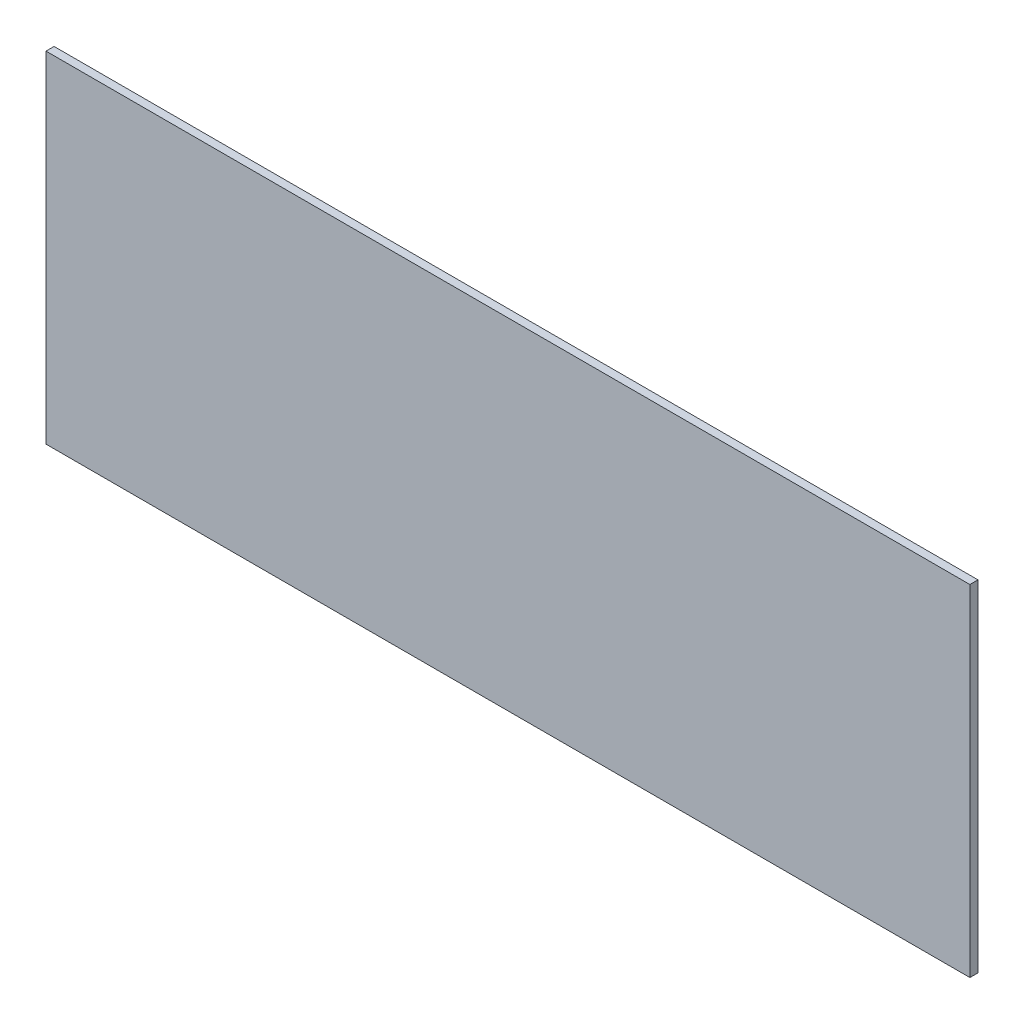
from build123d import *

# Parameters (mm, degrees)
ESQUISSE1_W        = 361.95
ESQUISSE1_H        = 133.35
BOSS_EXTRU_1_DEPTH = 1.5875


with BuildPart() as part:
    # Esquisse1 → Boss.-Extru.1 (new, symmetric)
    with BuildSketch(Plane.XY):
        Rectangle(ESQUISSE1_W, ESQUISSE1_H)
    extrude(amount=BOSS_EXTRU_1_DEPTH, both=True)


solid = part.part
